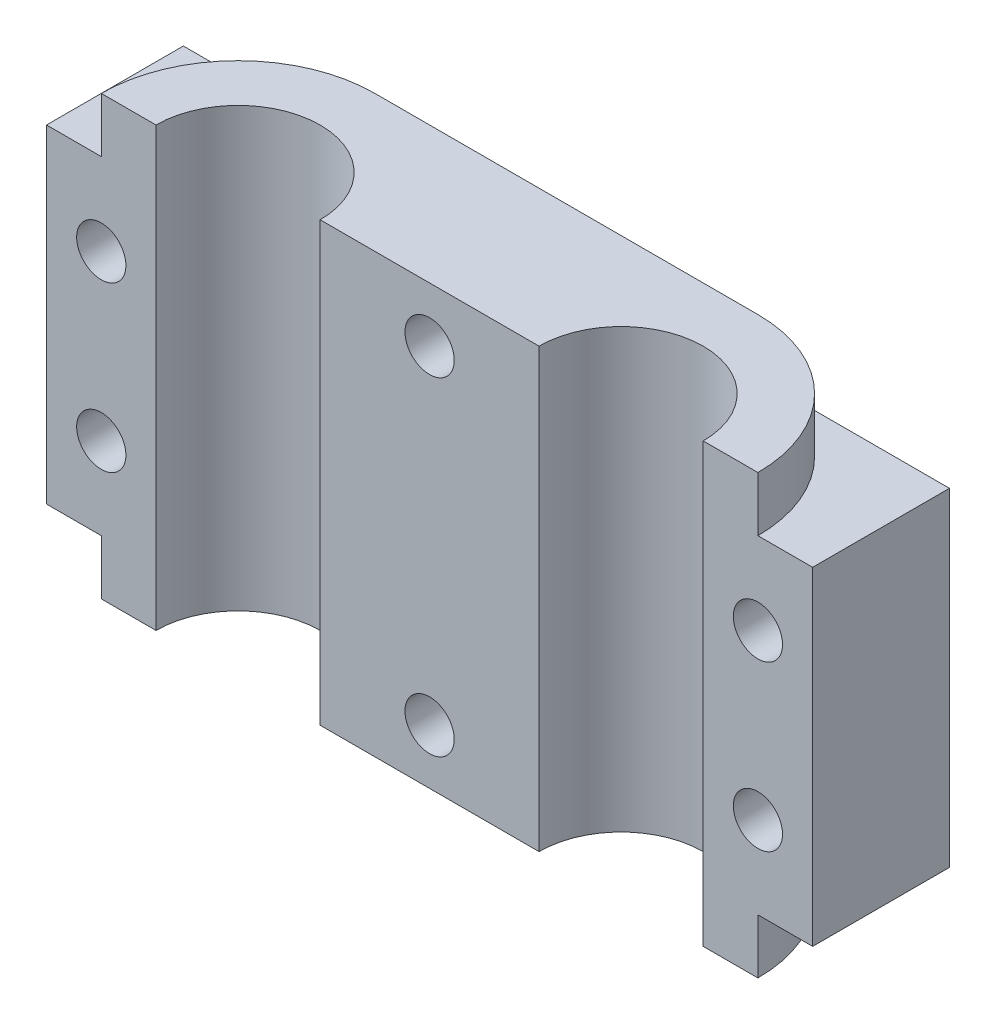
from build123d import *

# Parameters (mm, degrees)
BOSS_EXTRUDE1_DEPTH      = 15
BOSS_EXTRUDE2_DEPTH      = 5
BOSS_EXTRUDE2_DEPTH_BACK = 35
SKETCH3_R                = 2.25
CUT_EXTRUDE1_DEPTH       = 43.20485754


with BuildPart() as part:
    # Sketch1 → Boss-Extrude1 (new, symmetric)
    with BuildSketch(Plane(origin=(0, 0, 0), x_dir=(1, 0, 0), z_dir=(0, 1, 0))):
        with BuildLine():
            Line((-35, -0.11627907), (-35, -12.61627907))
            Line((-35, -12.61627907), (-25, -12.61627907))
            ThreePointArc((-25, -12.61627907), (-17.5, -5.11627907), (-10, -12.61627907))
            Line((-10, -12.61627907), (10, -12.61627907))
            ThreePointArc((10, -12.61627907), (17.5, -5.11627907), (25, -12.61627907))
            Line((25, -12.61627907), (35, -12.61627907))
            Line((35, -12.61627907), (35, -0.11627907))
            Line((35, -0.11627907), (-35, -0.11627907))
        make_face()
    extrude(amount=BOSS_EXTRUDE1_DEPTH, both=True)

    # Sketch2 → Boss-Extrude2 (add, two sides: drawn at the far end of the back side and taken through both)
    with BuildSketch(Plane(origin=(0, 15, 0), x_dir=(1, 0, 0), z_dir=(0, 1, 0)).offset(-BOSS_EXTRUDE2_DEPTH_BACK)):
        with BuildLine():
            Line((-17.5, -0.11627907), (17.5, -0.11627907))
            ThreePointArc((17.5, -0.11627907), (26.338834765, -3.777444305), (30, -12.61627907))
            Line((30, -12.61627907), (25, -12.61627907))
            ThreePointArc((25, -12.61627907), (17.5, -5.11627907), (10, -12.61627907))
            Line((10, -12.61627907), (5, -12.61627907))
            Line((5, -12.61627907), (-5, -12.61627907))
            Line((-5, -12.61627907), (-10, -12.61627907))
            ThreePointArc((-10, -12.61627907), (-17.5, -5.11627907), (-25, -12.61627907))
            Line((-25, -12.61627907), (-30, -12.61627907))
            ThreePointArc((-30, -12.61627907), (-26.338834765, -3.777444305), (-17.5, -0.11627907))
        make_face()
    extrude(amount=BOSS_EXTRUDE2_DEPTH + BOSS_EXTRUDE2_DEPTH_BACK)

    # Sketch3 → Cut-Extrude1 (cut, through all)
    with BuildSketch(Plane.XY.offset(12.61627907)):
        with Locations((-30, 7.5)):
            Circle(SKETCH3_R)
        with Locations((-30, -7.5)):
            Circle(SKETCH3_R)
        with Locations((0, 15)):
            Circle(SKETCH3_R)
        with Locations(Location((30, -7.5, 0), (0, 0, 180))):
            Circle(SKETCH3_R)
        with Locations(Location((30, 7.5, 0), (0, 0, 180))):
            Circle(SKETCH3_R)
        with Locations(Location((0, -15, 0), (0, 0, 180))):
            Circle(SKETCH3_R)
    extrude(amount=-CUT_EXTRUDE1_DEPTH, mode=Mode.SUBTRACT)


solid = part.part
